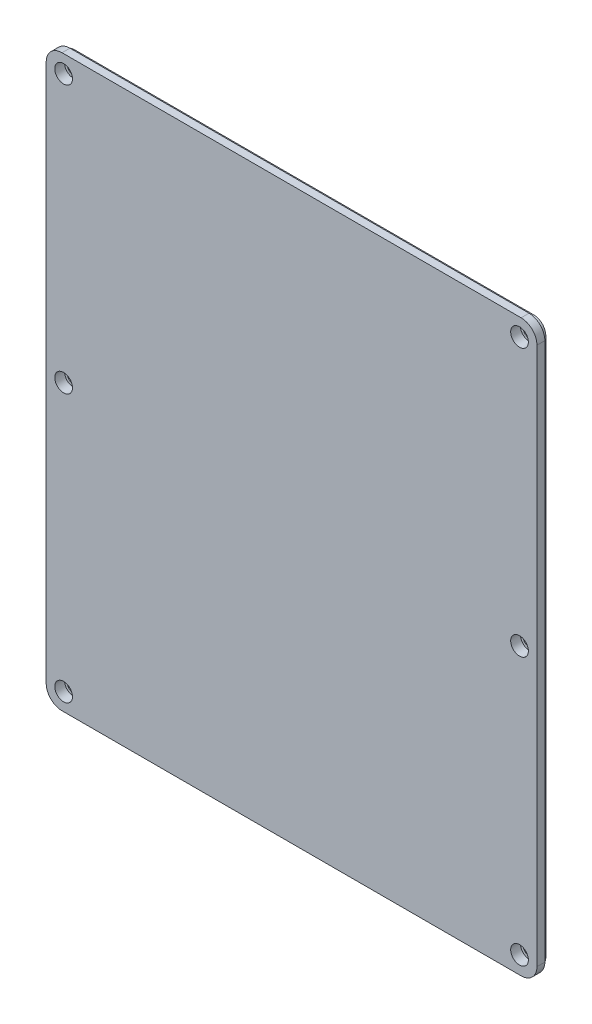
from build123d import *

# Parameters (mm, degrees)
SKETCH1_W                 = 155
SKETCH1_H                 = 180
BOSS_EXTRUDE1_DEPTH       = 4
FILLET1_R                 = 5
F_4_0MM_DOWEL_HOLE1_D     = 4
F_4_0MM_DOWEL_HOLE1_DEPTH = 3.1
SKETCH4_R                 = 1.95
CUT_EXTRUDE1_DEPTH        = 238.573146631
SKETCH5_R                 = 2.8
CUT_EXTRUDE2_DEPTH        = 3.1
CUT_EXTRUDE3_START        = -1.5
CUT_EXTRUDE3_DEPTH        = 1.5


with BuildPart() as part:
    # Sketch1 → Boss-Extrude1 (new body)
    with BuildSketch(Plane.XY):
        with Locations((77.5, 90)):
            Rectangle(SKETCH1_W, SKETCH1_H)
    extrude(amount=BOSS_EXTRUDE1_DEPTH)

    # Fillet1
    fillet1_edges = [part.edges().sort_by_distance(p)[0] for p in [
        (0, 180, 2),
        (155, 180, 2),
        (155, 0, 2),
        (0, 0, 2),
    ]]
    fillet(fillet1_edges, radius=FILLET1_R)

    # Ø4.0mm Dowel Hole1
    with Locations(Plane(origin=(0, 0, 0), x_dir=(-1, 0, 0), z_dir=(0, 0, -1))):
        with Locations((-60.95, 31.55), (-60.95, 61.55), (-61.95, 77.25), (-53.55, 107.55), (-61.95, 159.35), (-28.85, 107.55), (-22.6, 37.42), (-100.2, 19.55), (-98.45, 47.3), (-98.45, 75.05), (-110.45, 149.65), (-70.45, 149.65), (-70.45, 100.725), (-94.08, 100.725), (-148.75, 98.75), (-148.75, 127.85), (-148.75, 165.75), (-148.75, 136.65), (-141, 54.55), (-141, 34.05), (-137.55, 73.15), (-35.35, 50.590757681), (-125.355437925, 9.944755633), (-141, 9.944755633), (-141, 25.620981812), (-125.355437925, 25.620981812)):
            Hole(F_4_0MM_DOWEL_HOLE1_D / 2, depth=F_4_0MM_DOWEL_HOLE1_DEPTH)

    # Sketch4 → Cut-Extrude1 (cut, through all)
    with BuildSketch(Plane(origin=(0, 0, 0), x_dir=(-1, 0, 0), z_dir=(0, 0, -1))):
        with Locations((-5.5, 5.5)):
            Circle(SKETCH4_R)
        with Locations((-5.5, 90)):
            Circle(SKETCH4_R)
        with Locations((-5.5, 174.5)):
            Circle(SKETCH4_R)
        with Locations(Location((-149.5, 174.5, 0), (0, 0, 180))):
            Circle(SKETCH4_R)
        with Locations(Location((-149.5, 90, 0), (0, 0, 180))):
            Circle(SKETCH4_R)
        with Locations(Location((-149.5, 5.5, 0), (0, 0, 180))):
            Circle(SKETCH4_R)
    extrude(amount=-CUT_EXTRUDE1_DEPTH, mode=Mode.SUBTRACT)

    # Sketch5 → Cut-Extrude2 (cut)
    with BuildSketch(Plane.XY.offset(4)):
        with Locations((149.5, 5.5)):
            Circle(SKETCH5_R)
        with Locations((149.5, 90)):
            Circle(SKETCH5_R)
        with Locations((149.5, 174.5)):
            Circle(SKETCH5_R)
        with Locations((5.5, 174.5)):
            Circle(SKETCH5_R)
        with Locations((5.5, 90)):
            Circle(SKETCH5_R)
        with Locations((5.5, 5.5)):
            Circle(SKETCH5_R)
    extrude(amount=-CUT_EXTRUDE2_DEPTH, mode=Mode.SUBTRACT)

    # Sketch6 → Cut-Extrude3 (cut)
    with BuildSketch(Plane(origin=(0, 0, 0), x_dir=(-1, 0, 0), z_dir=(0, 0, -1)).offset(CUT_EXTRUDE3_START)):
        with BuildLine():
            Line((-150, 0), (-5, 0))
            ThreePointArc((-5, 0), (-1.464466094, 1.464466094), (0, 5))
            Line((0, 5), (0, 175))
            ThreePointArc((0, 175), (-1.464466094, 178.535533906), (-5, 180))
            Line((-5, 180), (-150, 180))
            ThreePointArc((-150, 180), (-153.535533906, 178.535533906), (-155, 175))
            Line((-155, 175), (-155, 5))
            ThreePointArc((-155, 5), (-153.535533906, 1.464466094), (-150, 0))
        make_face()
        with BuildLine():
            Line((-150, 1.2), (-5, 1.2))
            ThreePointArc((-5, 1.2), (-2.312994231, 2.312994231), (-1.2, 5))
            Line((-1.2, 5), (-1.2, 175))
            ThreePointArc((-1.2, 175), (-2.312994231, 177.687005769), (-5, 178.8))
            Line((-5, 178.8), (-150, 178.8))
            ThreePointArc((-150, 178.8), (-152.687005769, 177.687005769), (-153.8, 175))
            Line((-153.8, 175), (-153.8, 5))
            ThreePointArc((-153.8, 5), (-152.687005769, 2.312994231), (-150, 1.2))
        make_face(mode=Mode.SUBTRACT)
    extrude(amount=CUT_EXTRUDE3_DEPTH, mode=Mode.SUBTRACT)


solid = part.part
